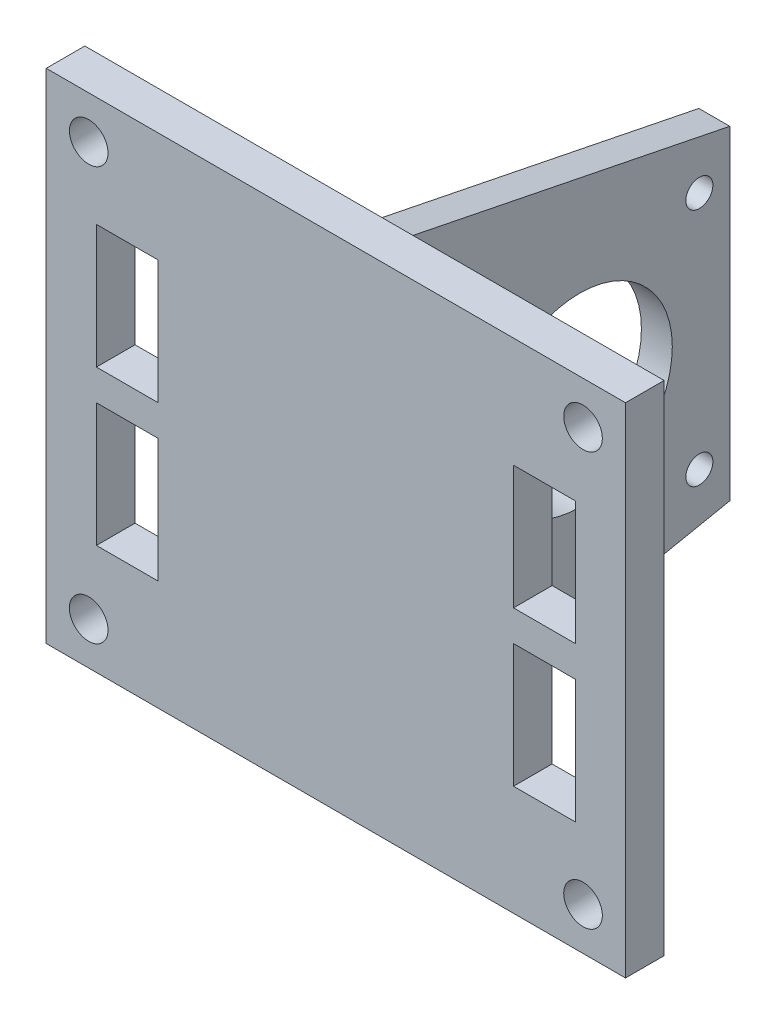
from build123d import *

# Parameters (mm, degrees)
SKETCH_1_W           = 75
SKETCH_1_H           = 64.5
EXTRUDE_1_DEPTH      = 5
EXTRUDE_2_DEPTH      = 2
EXTRUDE_2_DEPTH_BACK = 2
SKETCH_3_R           = 12
SKETCH_3_R_2         = 1.75
CUT_EXTRUDE_1_DEPTH  = 68.352152898
SKETCH_4_R           = 2.5
CUT_EXTRUDE_2_DEPTH  = 67.199037002
SKETCH_5_W           = 8
SKETCH_5_H           = 16
CUT_EXTRUDE_3_DEPTH  = 67.199037002


with BuildPart() as part:
    # 草圖1 → 填料-伸長1 (new body)
    with BuildSketch(Plane.XY):
        Rectangle(SKETCH_1_W, SKETCH_1_H)
    extrude(amount=EXTRUDE_1_DEPTH)

    # 草圖2 → 填料-伸長2 (add, two sides: drawn at the far end of the back side and taken through both)
    with BuildSketch(Plane(origin=(0, 0, 0), x_dir=(0, 0, -1), z_dir=(1, 0, 0)).offset(-EXTRUDE_2_DEPTH_BACK)):
        Polygon((0, 29.870222578), (0, 0), (0, -29.870222578), (44, -21), (44, 21), align=None)
    extrude(amount=EXTRUDE_2_DEPTH + EXTRUDE_2_DEPTH_BACK)

    # 草圖3 → 除料-伸長1 (cut, through all)
    with BuildSketch(Plane(origin=(2, 0, 0), x_dir=(0, 0, -1), z_dir=(1, 0, 0))):
        with Locations((24.559599052, 0)):
            Circle(SKETCH_3_R)
        with Locations((9.059599052, 15.5)):
            Circle(SKETCH_3_R_2)
        with Locations((40.059599052, 15.5)):
            Circle(SKETCH_3_R_2)
        with Locations((40.059599052, -15.5)):
            Circle(SKETCH_3_R_2)
        with Locations((9.059599052, -15.5)):
            Circle(SKETCH_3_R_2)
    extrude(amount=-CUT_EXTRUDE_1_DEPTH, mode=Mode.SUBTRACT)

    # 草圖4 → 除料-伸長2 (cut, through all)
    with BuildSketch(Plane(origin=(0, 0, 0), x_dir=(-1, 0, 0), z_dir=(0, 0, -1))):
        with Locations((32, 26.75)):
            Circle(SKETCH_4_R)
        with Locations(Location((32, -26.75, 0), (0, 0, 180))):
            Circle(SKETCH_4_R)
        with Locations((-32, -26.75)):
            Circle(SKETCH_4_R)
        with Locations(Location((-32, 26.75, 0), (0, 0, 180))):
            Circle(SKETCH_4_R)
    extrude(amount=-CUT_EXTRUDE_2_DEPTH, mode=Mode.SUBTRACT)

    # 草圖5 → 除料-伸長3 (cut, through all)
    with BuildSketch(Plane(origin=(0, 0, 0), x_dir=(-1, 0, 0), z_dir=(0, 0, -1))):
        with Locations((-27, 10)):
            Rectangle(SKETCH_5_W, SKETCH_5_H)
        with Locations((-27, -10)):
            Rectangle(SKETCH_5_W, SKETCH_5_H)
        with Locations((27, -10)):
            Rectangle(SKETCH_5_W, SKETCH_5_H)
        with Locations((27, 10)):
            Rectangle(SKETCH_5_W, SKETCH_5_H)
    extrude(amount=-CUT_EXTRUDE_3_DEPTH, mode=Mode.SUBTRACT)


solid = part.part
